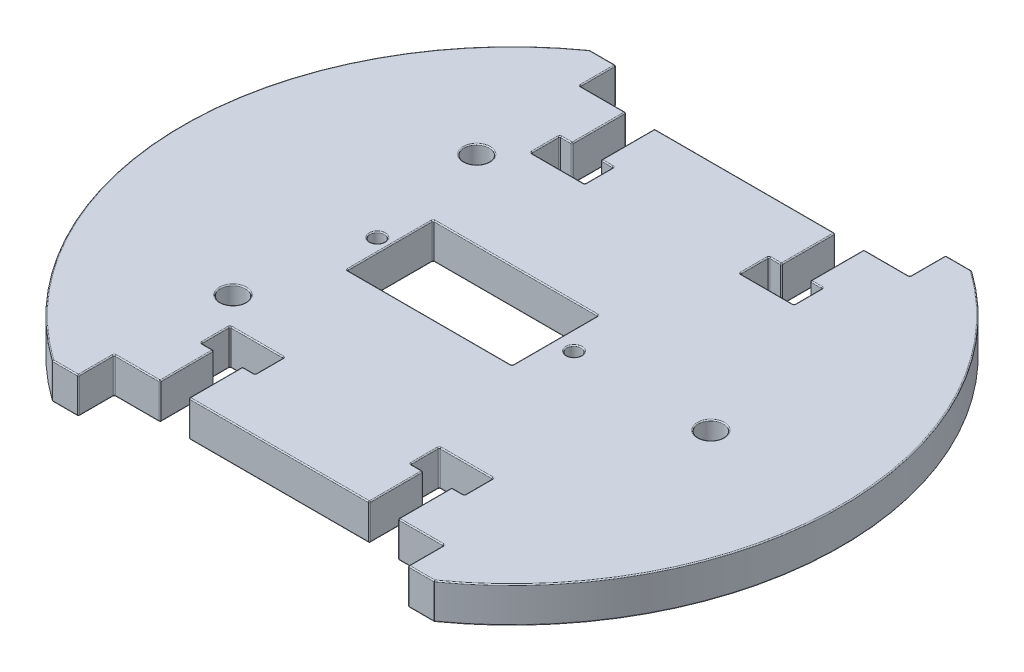
from build123d import *

# Parameters (mm, degrees)
SKETCH2_R           = 1
SKETCH2_R_2         = 1.75
SKETCH2_W           = 23
SKETCH2_H           = 12
BOSS_EXTRUDE2_DEPTH = 5
SKETCH3_W           = 4
SKETCH3_H           = 7.5
SKETCH3_W_2         = 7.5
SKETCH3_H_2         = 4
CUT_EXTRUDE1_DEPTH  = 60.558794481
FILLET1_R           = 0.15


with BuildPart() as part:
    # Sketch2 → Boss-Extrude2 (new body)
    with BuildSketch(Plane(origin=(0, 0, 0), x_dir=(1, 0, 0), z_dir=(0, 1, 0))):
        with BuildLine():
            Line((-26.64113361, 37.5), (-23, 37.5))
            Line((-23, 37.5), (-23, 32.5))
            Line((-23, 32.5), (23, 32.5))
            Line((23, 32.5), (23, 37.5))
            Line((23, 37.5), (26.64113361, 37.5))
            ThreePointArc((26.64113361, 37.5), (46, 0), (26.64113361, -37.5))
            Line((26.64113361, -37.5), (23, -37.5))
            Line((23, -37.5), (23, -32.5))
            Line((23, -32.5), (-23, -32.5))
            Line((-23, -32.5), (-23, -37.5))
            Line((-23, -37.5), (-26.64113361, -37.5))
            ThreePointArc((-26.64113361, -37.5), (-46, 0), (-26.64113361, 37.5))
        make_face()
        with Locations(Location((8.65, 0, 0), (0, 0, 270))):
            Circle(SKETCH2_R, mode=Mode.SUBTRACT)
        with Locations(Location((-18.8, 0, 0), (0, 0, 270))):
            Circle(SKETCH2_R, mode=Mode.SUBTRACT)
        with Locations(Location((27.75, 0, 0), (0, 0, 270))):
            Circle(SKETCH2_R_2, mode=Mode.SUBTRACT)
        with Locations(Location((-21.93, -17, 0), (0, 0, 270))):
            Circle(SKETCH2_R_2, mode=Mode.SUBTRACT)
        with Locations(Location((-21.93, 17, 0), (0, 0, 270))):
            Circle(SKETCH2_R_2, mode=Mode.SUBTRACT)
        with Locations((-5.5, 0)):
            Rectangle(SKETCH2_W, SKETCH2_H, mode=Mode.SUBTRACT)
    extrude(amount=BOSS_EXTRUDE2_DEPTH)

    # Sketch3 → Cut-Extrude1 (cut, through all)
    with BuildSketch(Plane(origin=(0, 5, 0), x_dir=(1, 0, 0), z_dir=(0, 1, 0))):
        with Locations((-14.6, 28.75)):
            Rectangle(SKETCH3_W, SKETCH3_H)
        with Locations((-14.6, 23)):
            Rectangle(SKETCH3_W_2, SKETCH3_H_2)
        with Locations((14.6, 23)):
            Rectangle(SKETCH3_W_2, SKETCH3_H_2)
        with Locations((14.6, 28.75)):
            Rectangle(SKETCH3_W, SKETCH3_H)
        with Locations((14.6, -28.75)):
            Rectangle(SKETCH3_W, SKETCH3_H)
        with Locations((14.6, -23)):
            Rectangle(SKETCH3_W_2, SKETCH3_H_2)
        with Locations((-14.6, -23)):
            Rectangle(SKETCH3_W_2, SKETCH3_H_2)
        with Locations((-14.6, -28.75)):
            Rectangle(SKETCH3_W, SKETCH3_H)
    extrude(amount=-CUT_EXTRUDE1_DEPTH, mode=Mode.SUBTRACT)

    # Fillet1
    fillet1_edges = [part.edges().sort_by_distance(p)[0] for p in [
        (-16.6, 5, -28.75),
        (-16.6, 2.5, -25),
        (-16.6, 2.5, -32.5),
        (-12.6, 0, -28.75),
        (-12.6, 2.5, -32.5),
        (-11.725, 0, -25),
        (-18.35, 0, -23),
        (-17.475, 0, -25),
        (-16.6, 0, -28.75),
        (-14.6, 5, -21),
        (-10.85, 5, -23),
        (-12.6, 5, -28.75),
        (-14.6, 0, -21),
        (-10.85, 2.5, -21),
        (-18.35, 5, -23),
        (-18.35, 2.5, -21),
        (-10.85, 0, -23),
        (-10.85, 2.5, -25),
        (-12.6, 2.5, -25),
        (-11.725, 5, -25),
        (-18.35, 2.5, -25),
        (-17.475, 5, -25),
        (-14.6, 5, 21),
        (-18.35, 2.5, 21),
        (-10.85, 5, 23),
        (-10.85, 2.5, 21),
        (-18.35, 0, 23),
        (-18.35, 2.5, 25),
        (-18.35, 5, 23),
        (-17.475, 5, 25),
        (-16.6, 5, 28.75),
        (-11.725, 5, 25),
        (-14.6, 0, 21),
        (-10.85, 0, 23),
        (-12.6, 0, 28.75),
        (-17.475, 0, 25),
        (-16.6, 2.5, 25),
        (-11.725, 0, 25),
        (-10.85, 2.5, 25),
        (-12.6, 2.5, 32.5),
        (-16.6, 0, 28.75),
        (-16.6, 2.5, 32.5),
        (-12.6, 5, 28.75),
        (-12.6, 2.5, 25),
        (-24.820566805, 0, -37.5),
        (-23, 0, -35),
        (14.6, 0, 21),
        (10.85, 2.5, 21),
        (18.35, 5, 23),
        (18.35, 2.5, 21),
        (10.85, 0, 23),
        (10.85, 2.5, 25),
        (14.6, 5, 21),
        (10.85, 5, 23),
        (12.6, 5, 28.75),
        (18.35, 0, 23),
        (17.475, 0, 25),
        (16.6, 0, 28.75),
        (11.725, 0, 25),
        (12.6, 2.5, 25),
        (11.725, 5, 25),
        (-23, 5, 35),
        (19.8, 0, -32.5),
        (18.35, 2.5, 25),
        (17.475, 5, 25),
        (16.6, 2.5, 32.5),
        (12.6, 0, 28.75),
        (12.6, 2.5, 32.5),
        (16.6, 5, 28.75),
        (16.6, 2.5, 25),
        (23, 0, -35),
        (12.6, 5, -28.75),
        (12.6, 2.5, -25),
        (12.6, 2.5, -32.5),
        (24.820566805, 0, -37.5),
        (16.6, 0, -28.75),
        (16.6, 2.5, -32.5),
        (14.6, 0, -21),
        (10.85, 0, -23),
        (12.6, 0, -28.75),
        (11.725, 5, -25),
        (18.35, 5, -23),
        (17.475, 5, -25),
        (16.6, 5, -28.75),
        (14.6, 5, -21),
        (18.35, 2.5, -21),
        (10.85, 5, -23),
        (10.85, 2.5, -21),
        (18.35, 0, -23),
        (18.35, 2.5, -25),
        (46, 0, 0),
        (17.475, 0, -25),
        (16.6, 2.5, -25),
        (11.725, 0, -25),
        (10.85, 2.5, -25),
        (24.820566805, 0, 37.5),
        (23, 0, 35),
        (-19.8, 0, 32.5),
        (-23, 0, 35),
        (-24.820566805, 0, 37.5),
        (-46, 0, 0),
        (-19.8, 5, 32.5),
        (-26.64113361, 2.5, -37.5),
        (-23, 2.5, -37.5),
        (-23, 2.5, -32.5),
        (23, 5, 35),
        (23, 2.5, -32.5),
        (23, 2.5, -37.5),
        (26.64113361, 2.5, -37.5),
        (26.64113361, 2.5, 37.5),
        (23, 2.5, 37.5),
        (23, 2.5, 32.5),
        (-23, 2.5, 32.5),
        (-23, 2.5, 37.5),
        (-26.64113361, 2.5, 37.5),
        (24.820566805, 5, 37.5),
        (46, 5, 0),
        (24.820566805, 5, -37.5),
        (6, 0, 0),
        (6, 2.5, 6),
        (-5.5, 0, -6),
        (6, 2.5, -6),
        (-17, 0, 0),
        (-17, 2.5, -6),
        (-5.5, 0, 6),
        (-17, 2.5, 6),
        (6, 5, 0),
        (-5.5, 5, -6),
        (-17, 5, 0),
        (-5.5, 5, 6),
        (23, 5, -35),
        (19.8, 5, -32.5),
        (8.65, 0, -1),
        (8.65, 5, -1),
        (-23, 5, -35),
        (27.75, 0, -1.75),
        (27.75, 5, -1.75),
        (-24.820566805, 5, -37.5),
        (-46, 5, 0),
        (-21.93, 0, 15.25),
        (-21.93, 5, 15.25),
        (-18.8, 0, -1),
        (-18.8, 5, -1),
        (-21.93, 0, -18.75),
        (-21.93, 5, -18.75),
        (0, 0, -32.5),
        (-19.8, 0, -32.5),
        (0, 5, -32.5),
        (-19.8, 5, -32.5),
        (0, 0, 32.5),
        (19.8, 0, 32.5),
        (0, 5, 32.5),
        (19.8, 5, 32.5),
        (-24.820566805, 5, 37.5),
    ]]
    fillet(fillet1_edges, radius=FILLET1_R)


solid = part.part
